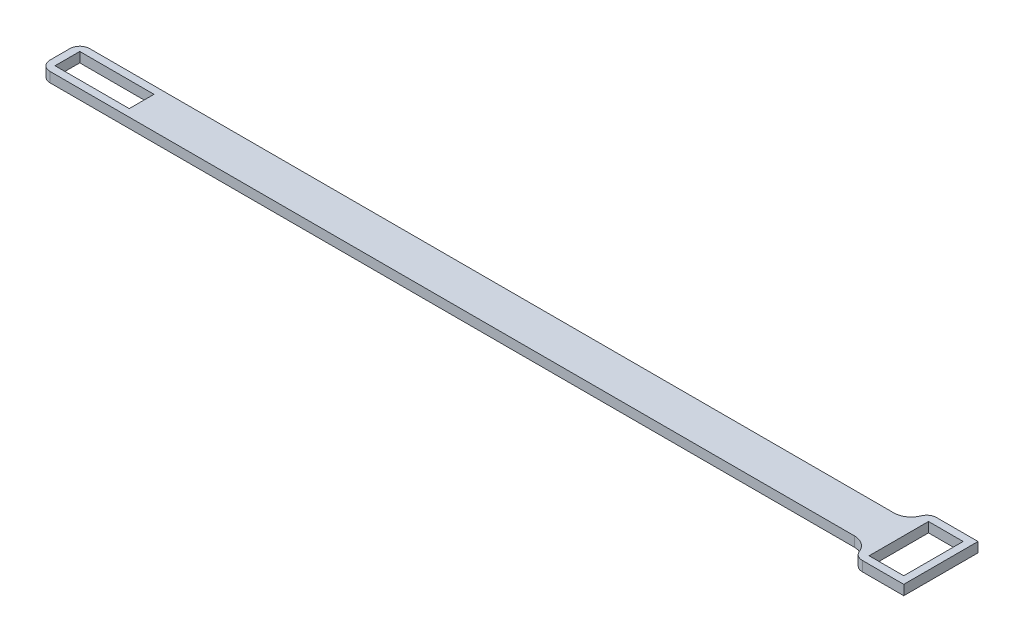
from build123d import *

# Parameters (mm, degrees)
SKETCH1_W           = 7
SKETCH1_H           = 12
SKETCH1_W_2         = 15
SKETCH1_H_2         = 5
BOSS_EXTRUDE1_DEPTH = 2
FILLET1_R           = 2


with BuildPart() as part:
    # Sketch1 → Boss-Extrude1 (new body)
    with BuildSketch(Plane(origin=(0, 0, 0), x_dir=(1, 0, 0), z_dir=(0, 1, 0))):
        with BuildLine():
            Line((-93, 4), (-93, -4))
            Line((-93, -4), (71.500000067, -4))
            ThreePointArc((71.500000067, -4), (73.974873758, -5.025126289), (75, -7.5))
            Line((75, -7.5), (85, -7.5))
            Line((85, -7.5), (85, 7.5))
            Line((85, 7.5), (75, 7.5))
            ThreePointArc((75, 7.5), (73.974873696, 5.025126228), (71.499999892, 4))
            Line((71.499999892, 4), (-93, 4))
        make_face()
        with Locations((80, 0)):
            Rectangle(SKETCH1_W, SKETCH1_H, mode=Mode.SUBTRACT)
        with Locations((-84, 0)):
            Rectangle(SKETCH1_W_2, SKETCH1_H_2, mode=Mode.SUBTRACT)
    extrude(amount=BOSS_EXTRUDE1_DEPTH)

    # Fillet1
    fillet1_edges = [part.edges().sort_by_distance(p)[0] for p in [
        (-93, 1, 4),
        (-93, 1, -4),
        (75, 1, -7.5),
        (75, 1, 7.5),
    ]]
    fillet(fillet1_edges, radius=FILLET1_R)


solid = part.part
